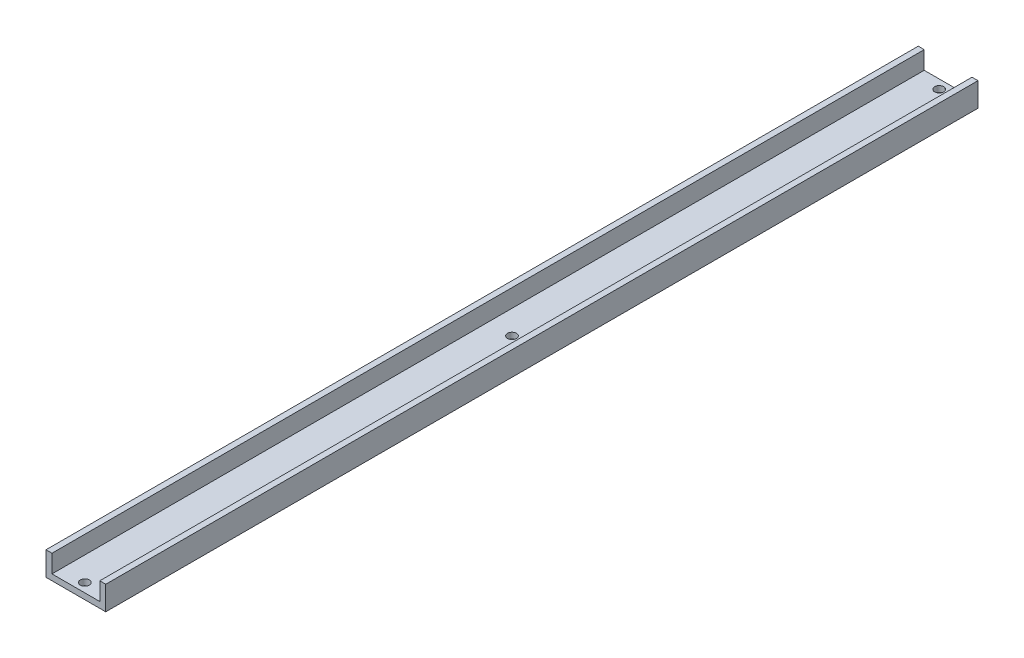
from build123d import *

# Parameters (mm, degrees)
BOSS_EXTRUDE1_DEPTH = 463.55
CUT_EXTRUDE1_REACH  = 466.734
SKETCH2_R           = 2.413
CUT_EXTRUDE2_REACH  = 466.734
SKETCH3_R           = 2.413


with BuildPart() as part:
    # Sketch1 → Boss-Extrude1 (new body)
    with BuildSketch(Plane.XY):
        Polygon((3.175, 3.175), (3.175, 12.7), (0, 12.7), (0, 0), (31.75, 0), (31.75, 12.7), (28.575, 12.7), (28.575, 3.175), align=None)
    extrude(amount=BOSS_EXTRUDE1_DEPTH)

    # Sketch2 → Cut-Extrude1 (cut, up to next)
    with BuildSketch(Plane(origin=(0, 3.175, 0), x_dir=(1, 0, 0), z_dir=(0, 1, 0)), mode=Mode.PRIVATE) as cut_extrude1_sk1:
        with Locations(Location((15.875, -458.7875, 0), (0, 0, 270))):
            Circle(SKETCH2_R)
    cut_extrude1_tool1 = extrude(cut_extrude1_sk1.sketch, amount=-CUT_EXTRUDE1_REACH, mode=Mode.PRIVATE) & part.part
    # Sketch2 → Cut-Extrude1 (cut, up to next)
    with BuildSketch(Plane(origin=(0, 3.175, 0), x_dir=(1, 0, 0), z_dir=(0, 1, 0)), mode=Mode.PRIVATE) as cut_extrude1_sk2:
        with Locations(Location((15.875, -4.7625, 0), (0, 0, 270))):
            Circle(SKETCH2_R)
    cut_extrude1_tool2 = extrude(cut_extrude1_sk2.sketch, amount=-CUT_EXTRUDE1_REACH, mode=Mode.PRIVATE) & part.part
    add(cut_extrude1_tool1.solids().sort_by_distance((15.875, 3.175, 458.7875))[0], mode=Mode.SUBTRACT)
    add(cut_extrude1_tool2.solids().sort_by_distance((15.875, 3.175, 4.7625))[0], mode=Mode.SUBTRACT)

    # Sketch3 → Cut-Extrude2 (cut, up to next)
    with BuildSketch(Plane(origin=(0, 3.175, 0), x_dir=(1, 0, 0), z_dir=(0, 1, 0)), mode=Mode.PRIVATE) as cut_extrude2_sk1:
        with Locations(Location((15.875, -231.775, 0), (0, 0, 270))):
            Circle(SKETCH3_R)
    cut_extrude2_tool1 = extrude(cut_extrude2_sk1.sketch, amount=-CUT_EXTRUDE2_REACH, mode=Mode.PRIVATE) & part.part
    add(cut_extrude2_tool1.solids().sort_by_distance((15.875, 3.175, 231.775))[0], mode=Mode.SUBTRACT)


solid = part.part
